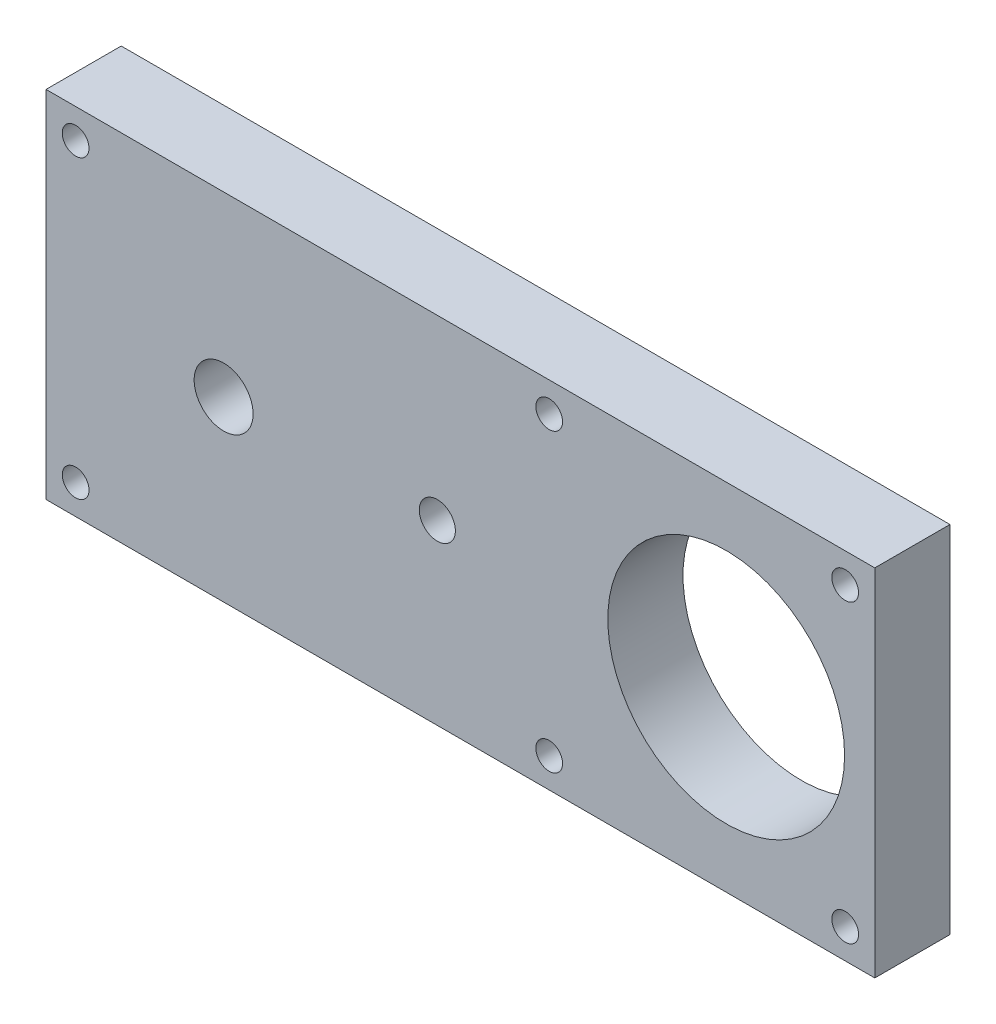
from build123d import *

# Parameters (mm, degrees)
SKETCH1_W             = 70
SKETCH1_H             = 30
BOSS_EXTRUDE1_DEPTH   = 6.35
F_2_CLEARANCE_HOLE1_D = 2.2606
SKETCH4_R             = 10
SKETCH4_R_2           = 2.4892
SKETCH4_R_3           = 1.525
CUT_EXTRUDE1_DEPTH    = 77.422002722


with BuildPart() as part:
    # Sketch1 → Boss-Extrude1 (new body)
    with BuildSketch(Plane.XY):
        with Locations((35, 15)):
            Rectangle(SKETCH1_W, SKETCH1_H)
    extrude(amount=BOSS_EXTRUDE1_DEPTH)

    # #2 Clearance Hole1 (through all)
    with Locations(Plane.XY.offset(6.35)):
        with Locations((2.5, 27.5), (42.5, 27.5), (67.5, 27.5), (67.5, 2.5), (42.5, 2.5), (2.5, 2.5)):
            Hole(F_2_CLEARANCE_HOLE1_D / 2)

    # Sketch4 → Cut-Extrude1 (cut, through all)
    with BuildSketch(Plane.XY.offset(6.35)):
        with Locations((57.45, 15)):
            Circle(SKETCH4_R)
        with Locations((15, 15)):
            Circle(SKETCH4_R_2)
        with Locations((33.05, 15)):
            Circle(SKETCH4_R_3)
    extrude(amount=-CUT_EXTRUDE1_DEPTH, mode=Mode.SUBTRACT)


solid = part.part
